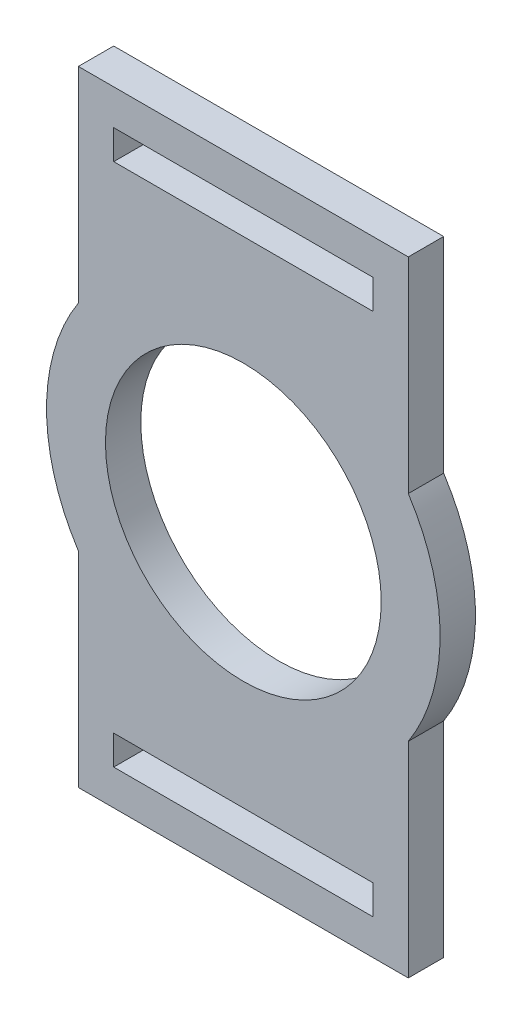
from build123d import *

# Parameters (mm, degrees)
CROQUIS1_R              = 11.7
CROQUIS1_W              = 22
CROQUIS1_H              = 2.5
SALIENTE_EXTRUIR1_DEPTH = 3


with BuildPart() as part:
    # Croquis1 → Saliente-Extruir1 (new body)
    with BuildSketch(Plane.XY):
        with BuildLine():
            Line((-14, 9.104394543), (-14, 26.5))
            Line((-14, 26.5), (14, 26.5))
            Line((14, 26.5), (14, 9.104394543))
            ThreePointArc((14, 9.104394543), (16.7, 0), (14, -9.104394543))
            Line((14, -9.104394543), (14, -26.5))
            Line((14, -26.5), (-14, -26.5))
            Line((-14, -26.5), (-14, -9.104394543))
            ThreePointArc((-14, -9.104394543), (-16.7, 0), (-14, 9.104394543))
        make_face()
        Circle(CROQUIS1_R, mode=Mode.SUBTRACT)
        with Locations((0, 22.25)):
            Rectangle(CROQUIS1_W, CROQUIS1_H, mode=Mode.SUBTRACT)
        with Locations((0, -22.25)):
            Rectangle(CROQUIS1_W, CROQUIS1_H, mode=Mode.SUBTRACT)
    extrude(amount=SALIENTE_EXTRUIR1_DEPTH)


solid = part.part
